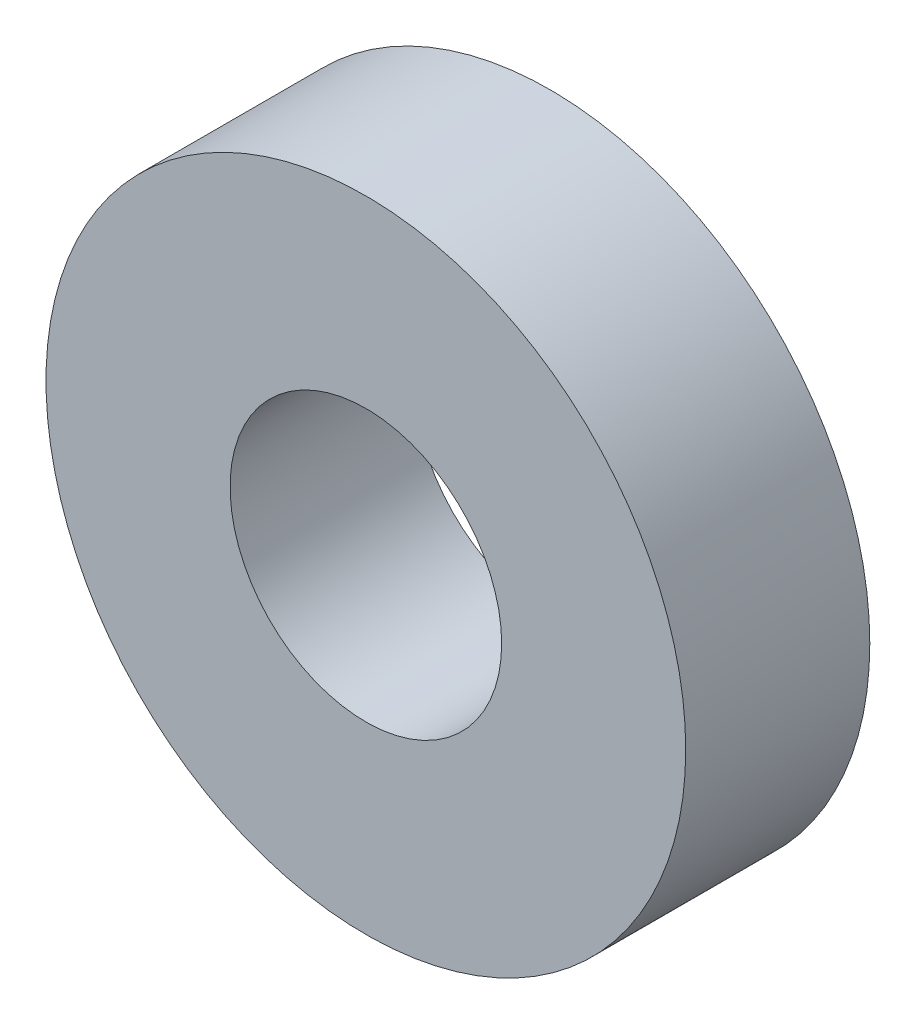
from build123d import *

# Parameters (mm, degrees)
SKETCH1_R           = 44.137106544
SKETCH1_R_2         = 18.737106544
BOSS_EXTRUDE1_DEPTH = 25.4


with BuildPart() as part:
    # Sketch1 → Boss-Extrude1 (new body)
    with BuildSketch(Plane.XY):
        with Locations((-82.561877338, 31.81060568)):
            Circle(SKETCH1_R)
        with Locations((-82.561877338, 31.81060568)):
            Circle(SKETCH1_R_2, mode=Mode.SUBTRACT)
    extrude(amount=BOSS_EXTRUDE1_DEPTH)


solid = part.part
